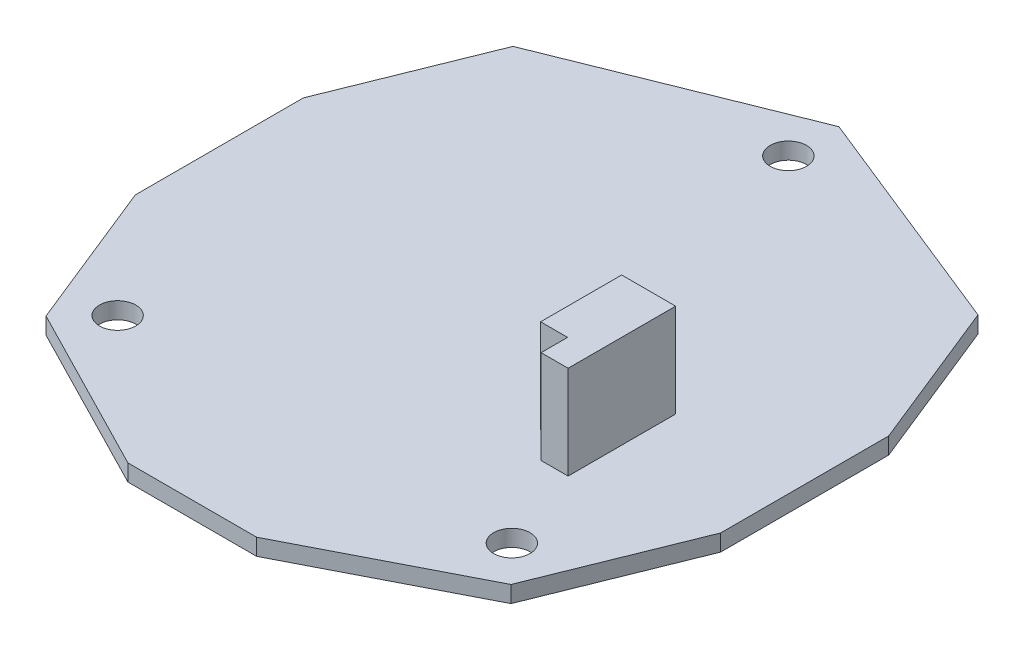
from build123d import *

# Parameters (mm, degrees)
BOSS_EXTRUDE1_DEPTH = 1.6
SKETCH2_R           = 1.75
CUT_EXTRUDE1_DEPTH  = 1.6
BOSS_EXTRUDE2_DEPTH = 9


with BuildPart() as part:
    # Sketch1 → Boss-Extrude1 (new body)
    with BuildSketch(Plane(origin=(0, 0, 0), x_dir=(1, 0, 0), z_dir=(0, 1, 0))):
        Polygon((0, 31.15), (22.4, 22.15), (28.2, 7.75), (28.2, -8.44), (22.4, -22.84), (6.2, -31.15), (-6.2, -31.15), (-22.4, -22.84), (-28.2, -8.44), (-28.2, 7.75), (-22.4, 22.15), align=None)
    extrude(amount=BOSS_EXTRUDE1_DEPTH)

    # Sketch2 → Cut-Extrude1 (cut)
    with BuildSketch(Plane(origin=(0, 1.6, 0), x_dir=(1, 0, 0), z_dir=(0, 1, 0))):
        with Locations(Location((0, 26.28, 0), (0, 0, 270))):
            Circle(SKETCH2_R)
        with Locations(Location((18.99, -19.35, 0), (0, 0, 270))):
            Circle(SKETCH2_R)
        with Locations(Location((-18.99, -19.35, 0), (0, 0, 90))):
            Circle(SKETCH2_R)
    extrude(amount=-CUT_EXTRUDE1_DEPTH, mode=Mode.SUBTRACT)

    # Sketch3 → Boss-Extrude2 (add)
    with BuildSketch(Plane(origin=(0, 1.6, 0), x_dir=(1, 0, 0), z_dir=(0, 1, 0))):
        Polygon((13.51, -8.5), (13.51, -11.05), (16.11, -11.05), (16.11, -0.69), (13.51, -0.69), (10.91, -0.69), (10.91, -8.5), align=None)
    extrude(amount=BOSS_EXTRUDE2_DEPTH)


solid = part.part
